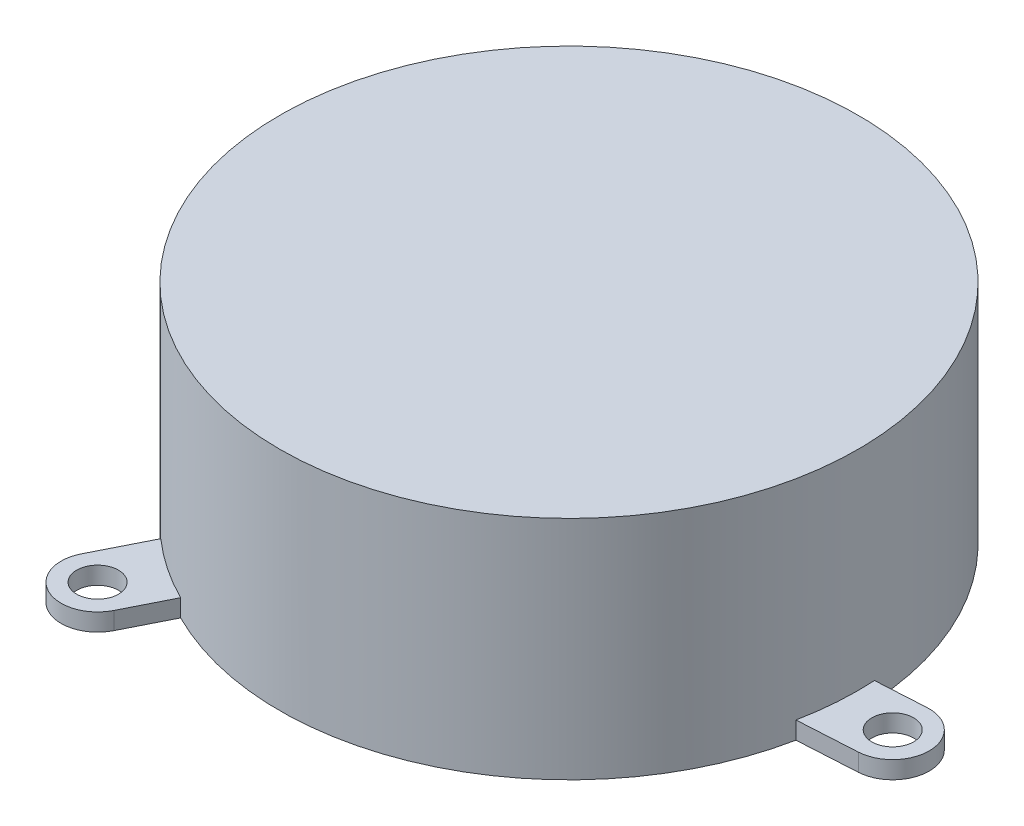
from build123d import *

# Parameters (mm, degrees)
SKETCH1_R           = 21.463
BOSS_EXTRUDE1_DEPTH = 16.8
SKETCH2_R           = 1.55
BOSS_EXTRUDE2_DEPTH = 1.3
CIRPATTERN1_COUNT   = 3


with BuildPart() as part:
    # Sketch1 → Boss-Extrude1 (new body)
    with BuildSketch(Plane(origin=(0, 0, 0), x_dir=(1, 0, 0), z_dir=(0, 1, 0))):
        Circle(SKETCH1_R)
    extrude(amount=BOSS_EXTRUDE1_DEPTH)

    # Sketch2 → Boss-Extrude2 (add)
    with BuildSketch(Plane.XZ):
        with BuildLine():
            Line((-14.167399247, 16.122815126), (-16.137353009, 20.042265188))
            ThreePointArc((-16.137353009, 20.042265188), (-14.933420138, 23.679331264), (-11.296354062, 22.475398393))
            Line((-11.296354062, 22.475398393), (-9.63856212, 19.177030251))
            ThreePointArc((-9.63856212, 19.177030251), (-12.000541932, 17.794588007), (-14.167399247, 16.122815126))
        make_face()
        with Locations((-13.716853536, 21.25883179)):
            Circle(SKETCH2_R, mode=Mode.SUBTRACT)
    boss_extrude2 = extrude(amount=-BOSS_EXTRUDE2_DEPTH)

    # CirPattern1: Boss-Extrude2 ×3 about axis
    cirpattern1_axis = Axis((0, 17.64, 0), (0, -1, 0))
    for i in range(1, CIRPATTERN1_COUNT):
        add(boss_extrude2.rotate(cirpattern1_axis, i * 360 / CIRPATTERN1_COUNT))


solid = part.part
